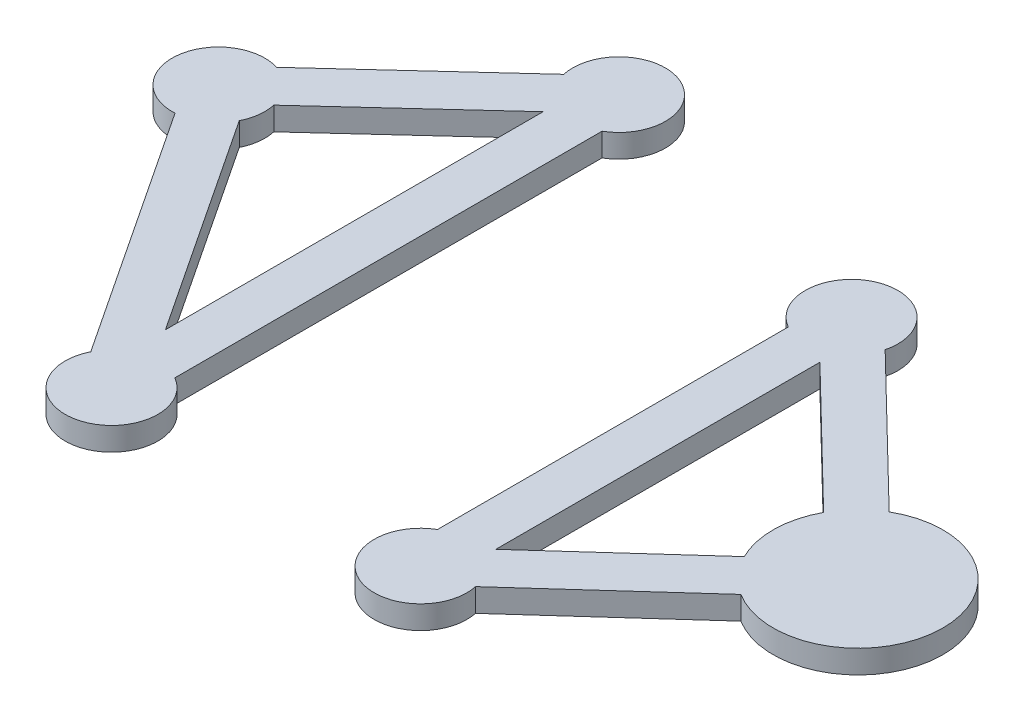
from build123d import *

# Parameters (mm, degrees)
EXTRUDE_1_DEPTH   = 3
EXTRUDE_1_2_DEPTH = 3


with BuildPart() as part:
    # Эскиз1 → Бобышка-Вытянуть1 (new body)
    with BuildSketch(Plane(origin=(0, 0, 0), x_dir=(1, 0, 0), z_dir=(0, 1, 0))):
        with BuildLine():
            Line((-65.230061637, 46.596691334), (-45.856153483, 64.394064938))
            ThreePointArc((-45.856153483, 64.394064938), (-37.586941576, 71.193373193), (-37, 60.503847577))
            Line((-37, 60.503847577), (-37, 5.196152423))
            ThreePointArc((-37, 5.196152423), (-38.272069955, -5.745803491), (-45.368443052, 2.679518464))
            Line((-45.368443052, 2.679518464), (-66.663474973, 34.883178825))
            ThreePointArc((-66.663474973, 34.883178825), (-72.98273861, 41.600945273), (-65.230061637, 46.596691334))
        make_face()
        with BuildLine():
            Line((-61.171011956, 42.178081181), (-43, 58.870443195))
            Line((-43, 58.870443195), (-43, 9.975757131))
            Line((-43, 9.975757131), (-61.658722387, 38.192627654))
            ThreePointArc((-61.658722387, 38.192627654), (-61.071592268, 40.143346965), (-61.171011956, 42.178081181))
        make_face(mode=Mode.SUBTRACT)
    extrude(amount=EXTRUDE_1_DEPTH)


with BuildPart() as body_2:
    # Эскиз1 → Extrude 1 2 (new body)
    with BuildSketch(Plane(origin=(0, 0, 0), x_dir=(1, 0, 0), z_dir=(0, 1, 0))):
        with BuildLine():
            Line((-3, 50.603847577), (-3, 5.196152423))
            ThreePointArc((-3, 5.196152423), (-2.436350888, -5.483082559), (5.867027349, 1.256180752))
            Line((5.867027349, 1.256180752), (23.916758133, 17.556812348))
            ThreePointArc((23.916758133, 17.556812348), (40.75840018, 26.67494221), (24.261886225, 36.403571423))
            Line((24.261886225, 36.403571423), (5.817101981, 54.329855603))
            ThreePointArc((5.817101981, 54.329855603), (-2.335551293, 61.326771223), (-3, 50.603847577))
        make_face()
        with BuildLine():
            Line((19.895360015, 22.009716701), (3, 6.751592212))
            Line((3, 6.751592212), (3, 48.700899365))
            Line((3, 48.700899365), (20.08015284, 32.10088553))
            ThreePointArc((20.08015284, 32.10088553), (18.762088009, 27.077745962), (19.895360015, 22.009716701))
        make_face(mode=Mode.SUBTRACT)
    extrude(amount=EXTRUDE_1_2_DEPTH)


solid = Compound([part.part, body_2.part])
